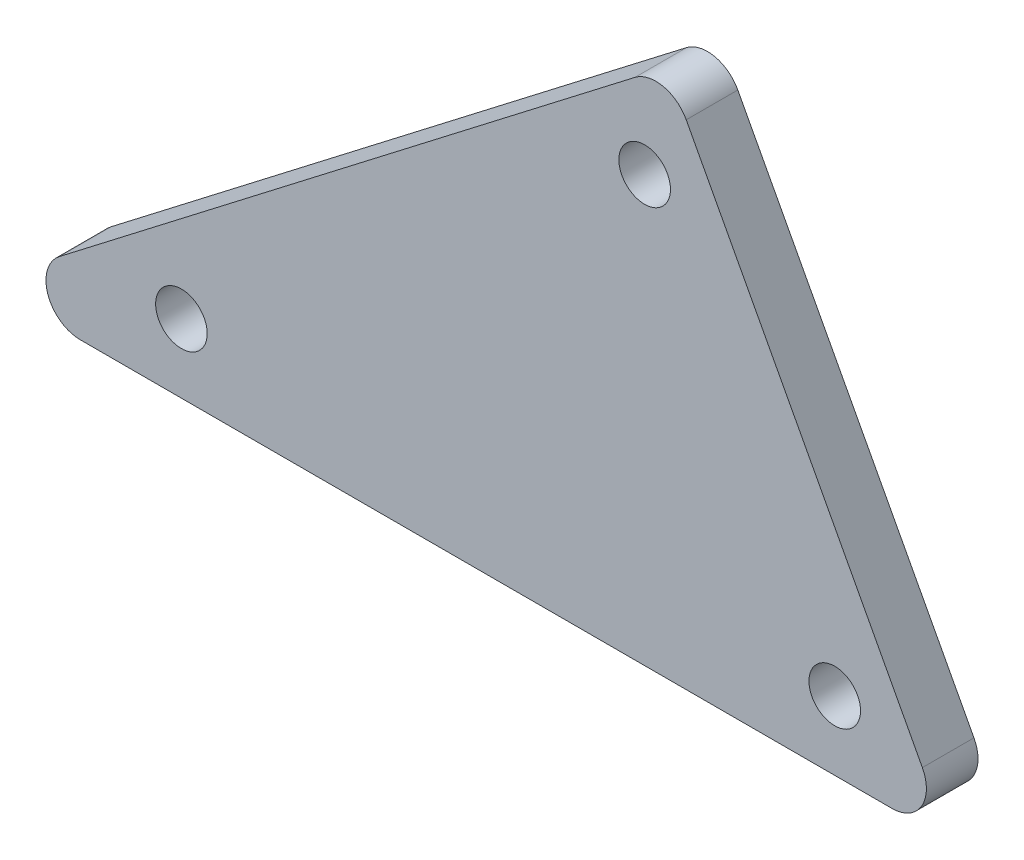
from build123d import *

# Parameters (mm, degrees)
ESQUISSE1_R        = 1.5
BOSS_EXTRU_1_DEPTH = 3
CONG_2_R           = 2


with BuildPart() as part:
    # Esquisse1 → Boss.-Extru.1 (new body)
    with BuildSketch(Plane.XY):
        Polygon((-49.755710808, -4), (-9.749908145, 26.789473423), (6.665609221, -4), align=None)
        with Locations((-11.055921053, 20.736841844)):
            Circle(ESQUISSE1_R, mode=Mode.SUBTRACT)
        with Locations((-38, 0)):
            Circle(ESQUISSE1_R, mode=Mode.SUBTRACT)
        Circle(ESQUISSE1_R, mode=Mode.SUBTRACT)
    extrude(amount=BOSS_EXTRU_1_DEPTH)

    # Congé2
    cong_2_edges = [part.edges().sort_by_distance(p)[0] for p in [
        (-49.755710808, -4, 1.5),
        (-9.749908145, 26.789473423, 1.5),
        (6.665609221, -4, 1.5),
    ]]
    fillet(cong_2_edges, radius=CONG_2_R)


solid = part.part
